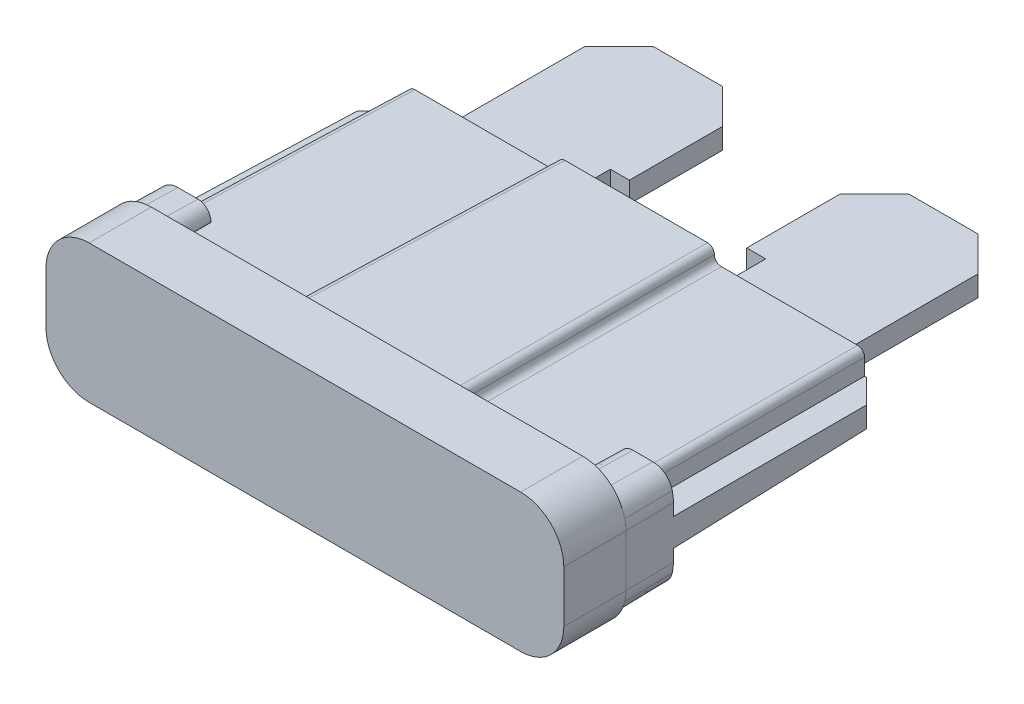
from build123d import *

# Parameters (mm, degrees)
SKETCH1_W                     = 19.05
SKETCH1_H                     = 5.08
BASE_EXTRUDE_DEPTH            = 2.286
FILLET1_R                     = 1.5875
BOSS_EXTRUDE3_DEPTH           = 9.906
BOSS_EXTRUDE3_TAPER           = 1
FILLET4_R                     = 0.254
BOSS_EXTRUDE4_DEPTH           = 1.778
BOSS_EXTRUDE4_DRAFT           = 1
BOSS_EXTRUDE4_PROFILE_2_DEPTH = 1.778
BOSS_EXTRUDE4_PROFILE_2_DRAFT = 1
SKETCH5_W                     = 1.861791545
SKETCH5_H                     = 1.016
BOSS_EXTRUDE6_DEPTH           = 8.128
BOSS_EXTRUDE6_DRAFT           = 1
BOSS_EXTRUDE6_PROFILE_2_DEPTH = 8.128
BOSS_EXTRUDE6_PROFILE_2_DRAFT = 1
BLADES_DEPTH                  = 0.381
CHAMFER1_SIZE                 = 0.889
CHAMFER1_SIZE2                = 0.90493105
CHAMFER1_EDGE_2_SIZE          = 0.889
CHAMFER1_EDGE_2_SIZE2         = 0.90493105


with BuildPart() as part:
    # Sketch1 → Base-Extrude (new body)
    with BuildSketch(Plane.XY):
        Rectangle(SKETCH1_W, SKETCH1_H)
    extrude(amount=-BASE_EXTRUDE_DEPTH)

    # Fillet1
    fillet1_edges = [part.edges().sort_by_distance(p)[0] for p in [
        (-9.525, 2.54, -1.143),
        (9.525, 2.54, -1.143),
        (9.525, -2.54, -1.143),
        (-9.525, -2.54, -1.143),
    ]]
    fillet(fillet1_edges, radius=FILLET1_R)

    # Sketch2 → Boss-Extrude3 (add)
    with BuildSketch(Plane(origin=(0, 0, -2.286), x_dir=(-1, 0, 0), z_dir=(0, 0, -1))):
        Polygon((-3.048, 1.905), (-3.048, 1.397), (-8.5725, 1.397), (-8.5725, -1.397), (-3.048, -1.397), (-3.048, -1.905), (3.048, -1.905), (3.048, -1.397), (8.5725, -1.397), (8.5725, 1.397), (3.048, 1.397), (3.048, 1.905), align=None)
    extrude(amount=BOSS_EXTRUDE3_DEPTH, taper=BOSS_EXTRUDE3_TAPER)

    # Fillet4
    fillet4_edges = [part.edges().sort_by_distance(p)[0] for p in [
        (-2.961545063, 1.818545063, -7.239),
        (-2.961545063, 1.310545063, -7.239),
        (-8.486045063, 1.310545063, -7.239),
        (-8.486045063, -1.310545063, -7.239),
        (-2.961545063, -1.310545063, -7.239),
        (-2.961545063, -1.818545063, -7.239),
        (2.961545063, -1.818545063, -7.239),
        (2.961545063, -1.310545063, -7.239),
        (8.486045063, -1.310545063, -7.239),
        (8.486045063, 1.310545063, -7.239),
        (2.961545063, 1.310545063, -7.239),
        (2.961545063, 1.818545063, -7.239),
    ]]
    fillet(fillet4_edges, radius=FILLET4_R)


with BuildPart() as boss_extrude4_tool:
    # Sketch3 → Boss-Extrude4 (with draft: the straight prism first)
    with BuildSketch(Plane(origin=(0, 0, -2.286), x_dir=(-1, 0, 0), z_dir=(0, 0, -1))):
        with BuildLine():
            ThreePointArc((-9.525, -0.9525), (-9.514251364, -1.136921759), (-9.482151011, -1.318846154))
            ThreePointArc((-9.482151011, -1.318846154), (-9.213290864, -1.74076198), (-8.740718526, -1.905))
            Line((-8.740718526, -1.905), (-8.001, -1.905))
            ThreePointArc((-8.001, -1.905), (-7.641789755, -1.756210245), (-7.493, -1.397))
            Line((-7.493, -1.397), (-7.493, 1.397))
            ThreePointArc((-7.493, 1.397), (-7.641789755, 1.756210245), (-8.001, 1.905))
            Line((-8.001, 1.905), (-8.740718526, 1.905))
            ThreePointArc((-8.740718526, 1.905), (-9.213290864, 1.74076198), (-9.482151011, 1.318846154))
            ThreePointArc((-9.482151011, 1.318846154), (-9.514251364, 1.136921759), (-9.525, 0.9525))
            Line((-9.525, 0.9525), (-9.525, -0.9525))
        make_face()
    extrude(amount=BOSS_EXTRUDE4_DEPTH)
    # Boss-Extrude4: the draft: its side faces are tilted about the plane it starts from
    boss_extrude4_sides = [boss_extrude4_tool.faces().sort_by_distance(p)[0] for p in [
        (9.514251364, 1.136921759, -3.175),
        (9.525, 0, -3.175),
        (9.514251364, -1.136921759, -3.175),
        (9.213290864, -1.74076198, -3.175),
        (8.370859263, -1.905, -3.175),
        (7.641789755, -1.756210245, -3.175),
        (7.493, 0, -3.175),
        (7.641789755, 1.756210245, -3.175),
        (8.370859263, 1.905, -3.175),
        (9.213290864, 1.74076198, -3.175),
    ]]
    draft(boss_extrude4_sides, Plane(origin=(0, 0, -2.286), x_dir=(-1, 0, 0), z_dir=(0, 0, -1)), BOSS_EXTRUDE4_DRAFT)


with BuildPart() as part_1:
    add(part.part)

    # Boss-Extrude4: add boss_extrude4_tool
    add(boss_extrude4_tool.part)


with BuildPart() as boss_extrude4_profile_2_tool:
    # Sketch3 → Boss-Extrude4 profile 2 (with draft: the straight prism first)
    with BuildSketch(Plane(origin=(0, 0, -2.286), x_dir=(-1, 0, 0), z_dir=(0, 0, -1))):
        with BuildLine():
            ThreePointArc((8.740718526, -1.905), (9.213290864, -1.74076198), (9.482151011, -1.318846154))
            ThreePointArc((9.482151011, -1.318846154), (9.514251364, -1.136921759), (9.525, -0.9525))
            Line((9.525, -0.9525), (9.525, 0.9525))
            ThreePointArc((9.525, 0.9525), (9.514251364, 1.136921759), (9.482151011, 1.318846154))
            ThreePointArc((9.482151011, 1.318846154), (9.213290864, 1.74076198), (8.740718526, 1.905))
            Line((8.740718526, 1.905), (8.001, 1.905))
            ThreePointArc((8.001, 1.905), (7.641789755, 1.756210245), (7.493, 1.397))
            Line((7.493, 1.397), (7.493, -1.397))
            ThreePointArc((7.493, -1.397), (7.641789755, -1.756210245), (8.001, -1.905))
            Line((8.001, -1.905), (8.740718526, -1.905))
        make_face()
    extrude(amount=BOSS_EXTRUDE4_PROFILE_2_DEPTH)
    # Boss-Extrude4 profile 2: the draft: its side faces are tilted about the plane it starts from
    boss_extrude4_profile_2_sides = [boss_extrude4_profile_2_tool.faces().sort_by_distance(p)[0] for p in [
        (-7.641789755, -1.756210245, -3.175),
        (-8.370859263, -1.905, -3.175),
        (-9.213290864, -1.74076198, -3.175),
        (-9.514251364, -1.136921759, -3.175),
        (-9.525, 0, -3.175),
        (-9.514251364, 1.136921759, -3.175),
        (-9.213290864, 1.74076198, -3.175),
        (-8.370859263, 1.905, -3.175),
        (-7.641789755, 1.756210245, -3.175),
        (-7.493, 0, -3.175),
    ]]
    draft(boss_extrude4_profile_2_sides, Plane(origin=(0, 0, -2.286), x_dir=(-1, 0, 0), z_dir=(0, 0, -1)), BOSS_EXTRUDE4_PROFILE_2_DRAFT)


with BuildPart() as part_2:
    add(part_1.part)

    # Boss-Extrude4 profile 2: add boss_extrude4_profile_2_tool
    add(boss_extrude4_profile_2_tool.part)


with BuildPart() as boss_extrude6_tool:
    # Sketch5 → Boss-Extrude6 (with draft: the straight prism first)
    with BuildSketch(Plane(origin=(0, 0, -4.064), x_dir=(-1, 0, 0), z_dir=(0, 0, -1))):
        with Locations((-8.563069122, 0)):
            Rectangle(SKETCH5_W, SKETCH5_H)
    extrude(amount=BOSS_EXTRUDE6_DEPTH)
    # Boss-Extrude6: the draft: its side faces are tilted about the plane it starts from
    boss_extrude6_sides = [boss_extrude6_tool.faces().sort_by_distance(p)[0] for p in [
        (9.493964895, 0, -8.128),
        (8.563069123, -0.508, -8.128),
        (7.63217335, 0, -8.128),
        (8.563069123, 0.508, -8.128),
    ]]
    draft(boss_extrude6_sides, Plane(origin=(0, 0, -4.064), x_dir=(-1, 0, 0), z_dir=(0, 0, -1)), BOSS_EXTRUDE6_DRAFT)


with BuildPart() as part_3:
    add(part_2.part)

    # Boss-Extrude6: add boss_extrude6_tool
    add(boss_extrude6_tool.part)


with BuildPart() as boss_extrude6_profile_2_tool:
    # Sketch5 → Boss-Extrude6 profile 2 (with draft: the straight prism first)
    with BuildSketch(Plane(origin=(0, 0, -4.064), x_dir=(-1, 0, 0), z_dir=(0, 0, -1))):
        with Locations((8.563069122, 0)):
            Rectangle(SKETCH5_W, SKETCH5_H)
    extrude(amount=BOSS_EXTRUDE6_PROFILE_2_DEPTH)
    # Boss-Extrude6 profile 2: the draft: its side faces are tilted about the plane it starts from
    boss_extrude6_profile_2_sides = [boss_extrude6_profile_2_tool.faces().sort_by_distance(p)[0] for p in [
        (-8.563069123, -0.508, -8.128),
        (-9.493964895, 0, -8.128),
        (-8.563069123, 0.508, -8.128),
        (-7.63217335, 0, -8.128),
    ]]
    draft(boss_extrude6_profile_2_sides, Plane(origin=(0, 0, -4.064), x_dir=(-1, 0, 0), z_dir=(0, 0, -1)), BOSS_EXTRUDE6_PROFILE_2_DRAFT)


with BuildPart() as part_4:
    add(part_3.part)

    # Boss-Extrude6 profile 2: add boss_extrude6_profile_2_tool
    add(boss_extrude6_profile_2_tool.part)

    # Sketch6 → Blades (add, symmetric)
    with BuildSketch(Plane(origin=(0, 0, 0), x_dir=(1, 0, 0), z_dir=(0, 1, 0))):
        Polygon((-7.239, 12.192), (-7.239, 17.526), (-5.969, 18.796), (-3.429, 18.796), (-2.159, 17.526), (-2.159, 14.097), (-2.8575, 14.097), (-2.8575, 12.192), align=None)
        Polygon((2.8575, 12.192), (7.239, 12.192), (7.239, 17.526), (5.969, 18.796), (3.429, 18.796), (2.159, 17.526), (2.159, 14.097), (2.8575, 14.097), align=None)
    extrude(amount=BLADES_DEPTH, both=True)

    # Chamfer1
    chamfer1_edges = [part_4.edges().sort_by_distance(p)[0] for p in [
        (9.352090127, 0, -12.192),
    ]]
    chamfer1_side = [part_4.faces().sort_by_distance(p)[0] for p in [
        (5e-09, -1.9e-08, -12.192),
    ]]
    chamfer(chamfer1_edges, length=CHAMFER1_SIZE, length2=CHAMFER1_SIZE2, reference=chamfer1_side[0])

    # Chamfer1 edge 2
    chamfer1_edge_2_edges = [part_4.edges().sort_by_distance(p)[0] for p in [
        (-9.352090127, 0, -12.192),
    ]]
    chamfer1_edge_2_side = [part_4.faces().sort_by_distance(p)[0] for p in [
        (5e-09, -1.9e-08, -12.192),
    ]]
    chamfer(chamfer1_edge_2_edges, length=CHAMFER1_EDGE_2_SIZE, length2=CHAMFER1_EDGE_2_SIZE2, reference=chamfer1_edge_2_side[0])


solid = part_4.part
